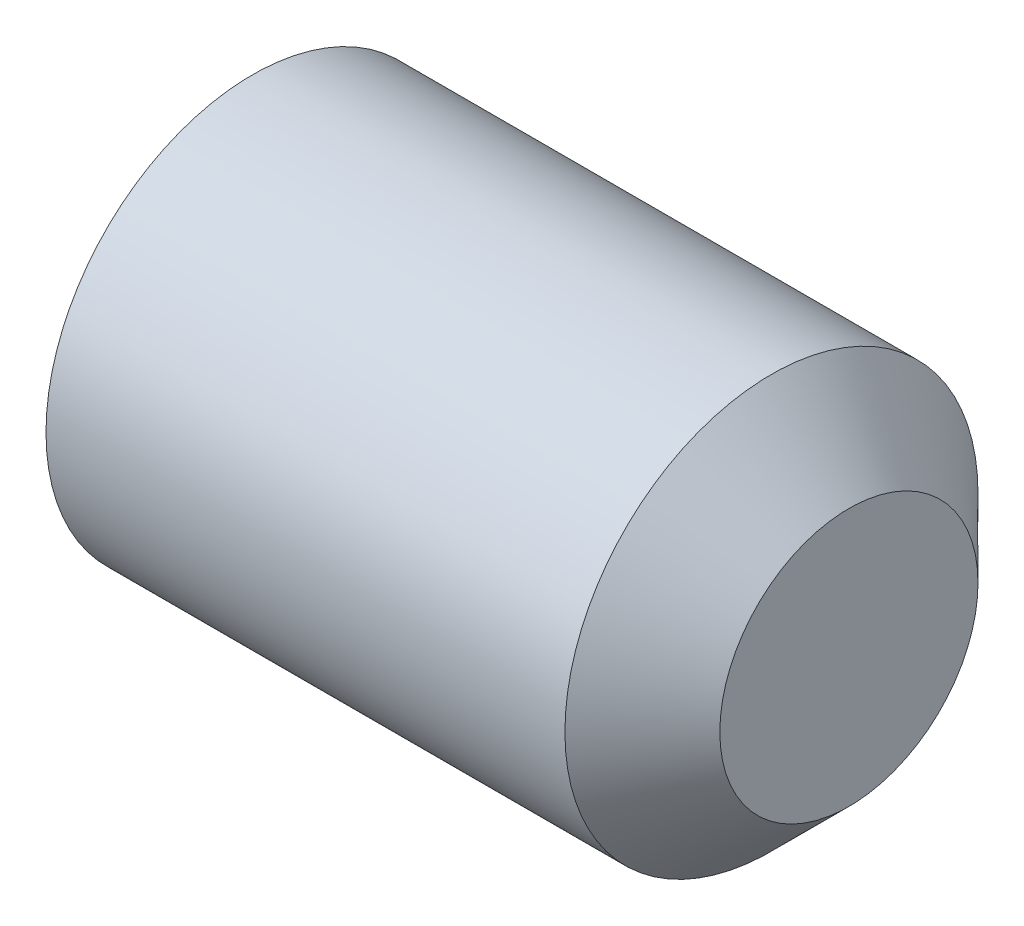
from build123d import *

# Parameters (mm, degrees)
HEX_2_DEPTH = 2.5


with BuildPart() as part:
    # BodySke → BaseBody (revolve)
    with BuildSketch(Plane.XY, mode=Mode.PRIVATE) as basebody_sk:
        Polygon((0, 0), (0, 1.61), (0.225166605, 2), (5.25, 2), (6, 1.25), (6, 0), align=None)
    revolve(basebody_sk.sketch.rotate(Axis((-12.7, 0, 0), (1, 0, 0)), 90), axis=Axis((-12.7, 0, 0), (1, 0, 0)))

    # Sketch2 → Hex 2 (cut)
    with BuildSketch(Plane.ZY):
        Polygon((0.577350269, 1), (-0.577350269, 1), (-1.154700538, 0), (-0.577350269, -1), (0.577350269, -1), (1.154700538, 0), align=None)
    extrude(amount=-HEX_2_DEPTH, mode=Mode.SUBTRACT)


solid = part.part
